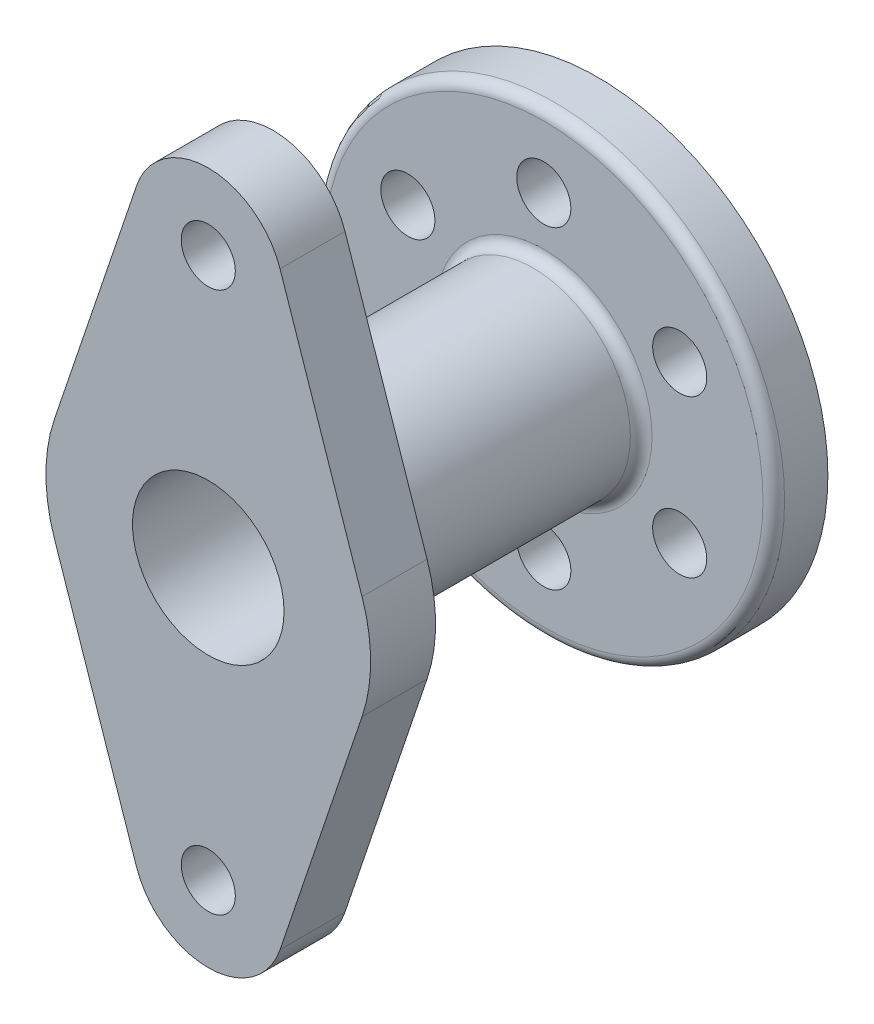
from build123d import *

# Parameters (mm, degrees)
SKETCH1_R                                          = 42.5
BOSS_EXTRUDE1_DEPTH                                = 10
SKETCH2_R                                          = 5
CUT_EXTRUDE1_DEPTH                                 = 61.930288035
CIRPATTERN2_COUNT                                  = 6
SKETCH3_R                                          = 18
BOSS_EXTRUDE2_DEPTH                                = 50
BOSS_EXTRUDE3_DEPTH                                = 12
SKETCH5_R                                          = 5
CUT_EXTRUDE3_DEPTH                                 = 106.291262695
CBORE_FOR_M2_5_PAN_HEAD_MACHINE_SCREW1_D           = 20
CBORE_FOR_M2_5_PAN_HEAD_MACHINE_SCREW1_CBORE_D     = 28
CBORE_FOR_M2_5_PAN_HEAD_MACHINE_SCREW1_CBORE_DEPTH = 25
FILLET1_R                                          = 2


with BuildPart() as part:
    # Sketch1 → Boss-Extrude1 (new body)
    with BuildSketch(Plane.XY):
        Circle(SKETCH1_R)
    extrude(amount=BOSS_EXTRUDE1_DEPTH)

    # Sketch2 → Cut-Extrude1 (cut, through all)
    with BuildSketch(Plane.XY.offset(10)):
        with Locations((0, 29)):
            Circle(SKETCH2_R)
    cut_extrude1 = extrude(amount=-CUT_EXTRUDE1_DEPTH, mode=Mode.SUBTRACT)

    # CirPattern2: Cut-Extrude1 ×6 about axis
    cirpattern2_axis = Axis((0, 0, 0), (0, 0, 1))
    for i in range(1, CIRPATTERN2_COUNT):
        add(cut_extrude1.rotate(cirpattern2_axis, i * 360 / CIRPATTERN2_COUNT), mode=Mode.SUBTRACT)

    # Sketch3 → Boss-Extrude2 (add)
    with BuildSketch(Plane.XY.offset(10)):
        Circle(SKETCH3_R)
    extrude(amount=BOSS_EXTRUDE2_DEPTH)

    # Sketch4 → Boss-Extrude3 (add)
    with BuildSketch(Plane.XY.offset(60)):
        with BuildLine():
            Line((-13.263845596, 54.48), (-28.422526278, 9.6))
            ThreePointArc((-28.422526278, 9.6), (-30, 0), (-28.422526278, -9.6))
            Line((-28.422526278, -9.6), (-13.263845596, -54.48))
            ThreePointArc((-13.263845596, -54.48), (0, -64), (13.263845596, -54.48))
            Line((13.263845596, -54.48), (28.422526278, -9.6))
            ThreePointArc((28.422526278, -9.6), (30, 0), (28.422526278, 9.6))
            Line((28.422526278, 9.6), (13.263845596, 54.48))
            ThreePointArc((13.263845596, 54.48), (0, 64), (-13.263845596, 54.48))
        make_face()
    extrude(amount=BOSS_EXTRUDE3_DEPTH)

    # Sketch5 → Cut-Extrude3 (cut, through all)
    with BuildSketch(Plane.XY.offset(72)):
        with Locations((0, 50)):
            Circle(SKETCH5_R)
    cut_extrude3 = extrude(amount=-CUT_EXTRUDE3_DEPTH, mode=Mode.SUBTRACT)

    # Mirror1: Cut-Extrude3 across plane
    add(cut_extrude3.mirror(Plane.ZX), mode=Mode.SUBTRACT)

    # CBORE for M2.5 Pan Head Machine Screw1 (through all)
    with Locations(Plane.XY.offset(72)):
        with Locations((0, 0)):
            CounterBoreHole(CBORE_FOR_M2_5_PAN_HEAD_MACHINE_SCREW1_D / 2, CBORE_FOR_M2_5_PAN_HEAD_MACHINE_SCREW1_CBORE_D / 2, CBORE_FOR_M2_5_PAN_HEAD_MACHINE_SCREW1_CBORE_DEPTH)

    # Fillet1
    fillet1_edges = [part.edges().sort_by_distance(p)[0] for p in [
        (-18, 0, 10),
        (-42.5, 0, 10),
    ]]
    fillet(fillet1_edges, radius=FILLET1_R)


solid = part.part
